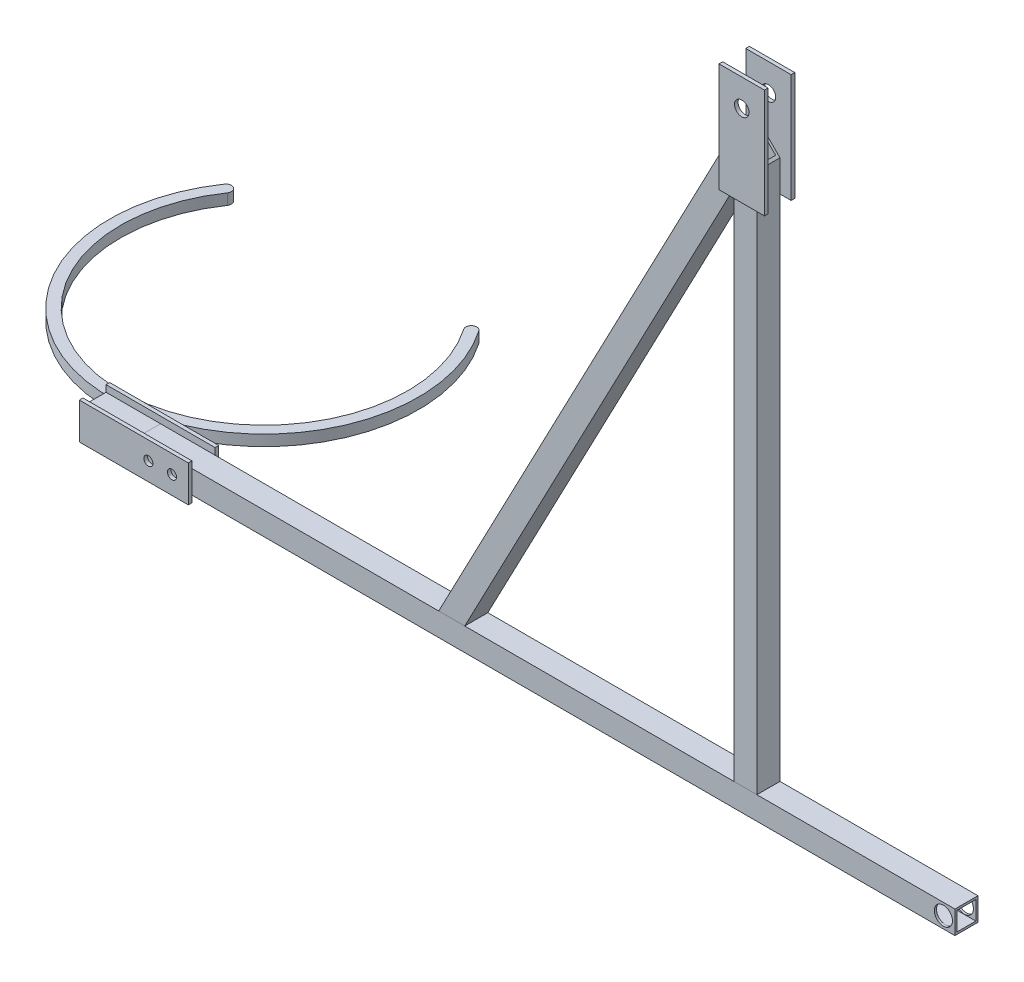
from build123d import *

# Parameters (mm, degrees)
SKETCH1_W               = 450
SKETCH1_H               = 12.7
SKETCH1_R               = 5
BOSS_EXTRUDE1_DEPTH     = 6.35
SHELL1_T                = -1.2
BOSS_EXTRUDE2_DEPTH     = 6.35
SHELL2_T                = -1.2
BOSS_EXTRUDE3_DEPTH     = 6.35
SHELL3_T                = -1.2
BOSS_EXTRUDE4_START     = 6.35
SKETCH1_5_W             = 25
SKETCH1_5_H             = 60
SKETCH1_5_R             = 4
BOSS_EXTRUDE4_DEPTH     = 2
CUT_EXTRUDE1_DEPTH      = 563.897297471
CUT_EXTRUDE1_DEPTH_BACK = 563.897297471
SKETCH1_6_R             = 5
SKETCH2_W               = 30
SKETCH2_H               = 12.7
SKETCH2_R               = 2.5
BOSS_EXTRUDE5_DEPTH     = 2
SKETCH4_W               = 12.7
SKETCH4_H               = 12.7
SKETCH4_W_2             = 10.3
SKETCH4_H_2             = 10.3
BOSS_EXTRUDE7_DEPTH     = 30
BOSS_EXTRUDE8_START     = -12.7
SKETCH2_6_W             = 30
SKETCH2_6_H             = 12.7
SKETCH2_6_R             = 2.5
BOSS_EXTRUDE8_DEPTH     = 2
BOSS_EXTRUDE9_DEPTH     = 3


with BuildPart() as part:
    # Sketch1 → Boss-Extrude1 (new, symmetric)
    # profile 1 of 2: a face of its own
    with BuildSketch(Plane.XY):
        with Locations((-218.65, 0)):
            Rectangle(SKETCH1_W, SKETCH1_H)
        Circle(SKETCH1_R, mode=Mode.SUBTRACT)
    # profile 2 of 2: a face of its own
    with BuildSketch(Plane.XY):
        Circle(SKETCH1_R)
    extrude(amount=BOSS_EXTRUDE1_DEPTH, both=True)

    # Shell1
    shell1_openings = [part.faces().sort_by_distance(p)[0] for p in [
        (-443.65, 0, 0),
        (6.35, 0, 0),
    ]]
    offset(amount=SHELL1_T, openings=shell1_openings, kind=Kind.INTERSECTION)

    # Sketch1<6> → Cut-Extrude1 (cut, two sides: drawn at the far end of the back side and taken through both)
    with BuildSketch(Plane.XY.offset(-CUT_EXTRUDE1_DEPTH_BACK)):
        Circle(SKETCH1_6_R)
    extrude(amount=CUT_EXTRUDE1_DEPTH + CUT_EXTRUDE1_DEPTH_BACK, mode=Mode.SUBTRACT)


with BuildPart() as body_2:
    # Sketch1<3> → Boss-Extrude2 (new, symmetric)
    with BuildSketch(Plane.XY):
        Polygon((-115.35, 288.99291613), (-115.35, 316.35), (-277.830768093, 6.35), (-263.492058415, 6.35), align=None)
    extrude(amount=BOSS_EXTRUDE2_DEPTH, both=True)

    # Shell2
    shell2_openings = [body_2.faces().sort_by_distance(p)[0] for p in [
        (-270.661413254, 6.35, 0),
        (-115.35, 302.671458065, 0),
    ]]
    offset(amount=SHELL2_T, openings=shell2_openings, kind=Kind.INTERSECTION)


with BuildPart() as body_3:
    # Sketch1<4> → Boss-Extrude3 (new, symmetric)
    with BuildSketch(Plane.XY):
        Polygon((-102.65, 303.65), (-115.35, 316.35), (-115.35, 6.35), (-102.65, 6.35), align=None)
    extrude(amount=BOSS_EXTRUDE3_DEPTH, both=True)

    # Shell3
    shell3_openings = [body_3.faces().sort_by_distance(p)[0] for p in [
        (-109, 6.35, 0),
        (-109, 310, 0),
    ]]
    offset(amount=SHELL3_T, openings=shell3_openings, kind=Kind.INTERSECTION)


with BuildPart() as body_4:
    # Sketch1<5> → Boss-Extrude4 (new body)
    with BuildSketch(Plane.XY.offset(BOSS_EXTRUDE4_START)):
        with Locations((-109, 316.35)):
            Rectangle(SKETCH1_5_W, SKETCH1_5_H)
        with Locations((-109, 331.35)):
            Circle(SKETCH1_5_R, mode=Mode.SUBTRACT)
    extrude(amount=BOSS_EXTRUDE4_DEPTH)


with BuildPart() as body_5:
    # Mirror1: mirrored copy
    add(body_4.part.mirror(Plane.XY))


with BuildPart() as body_6:
    # Sketch2 → Boss-Extrude5 (new body)
    # profile 1 of 4: a face of its own
    with BuildSketch(Plane.XY.offset(6.35)):
        Polygon((-443.65, -6.35), (-473.65, -6.35), (-473.65, -10), (-413.65, -10), (-413.65, -6.35), align=None)
    # profile 2 of 4: a face of its own
    with BuildSketch(Plane.XY.offset(6.35)):
        with Locations((-428.65, 0)):
            Rectangle(SKETCH2_W, SKETCH2_H)
        with Locations((-435.65, 0)):
            Circle(SKETCH2_R, mode=Mode.SUBTRACT)
        with Locations((-422.65, 0)):
            Circle(SKETCH2_R, mode=Mode.SUBTRACT)
    # profile 3 of 4: a face of its own
    with BuildSketch(Plane.XY.offset(6.35)):
        with Locations((-458.65, 0)):
            Rectangle(SKETCH2_W, SKETCH2_H)
    # profile 4 of 4: a face of its own
    with BuildSketch(Plane.XY.offset(6.35)):
        Polygon((-413.65, 10), (-473.65, 10), (-473.65, 6.35), (-443.65, 6.35), (-413.65, 6.35), align=None)
    extrude(amount=BOSS_EXTRUDE5_DEPTH)


with BuildPart() as body_7:
    # Sketch4 → Boss-Extrude7 (new body)
    with BuildSketch(Plane.ZY.offset(443.65)):
        Rectangle(SKETCH4_W, SKETCH4_H)
        Rectangle(SKETCH4_W_2, SKETCH4_H_2, mode=Mode.SUBTRACT)
    extrude(amount=BOSS_EXTRUDE7_DEPTH)


with BuildPart() as body_8:
    # Sketch2<6> → Boss-Extrude8 (new body)
    # profile 1 of 4: a face of its own
    with BuildSketch(Plane.XY.offset(6.35).offset(BOSS_EXTRUDE8_START)):
        Polygon((-443.65, -6.35), (-473.65, -6.35), (-473.65, -10), (-413.65, -10), (-413.65, -6.35), align=None)
    # profile 2 of 4: a face of its own
    with BuildSketch(Plane.XY.offset(6.35).offset(BOSS_EXTRUDE8_START)):
        with Locations((-458.65, 0)):
            Rectangle(SKETCH2_6_W, SKETCH2_6_H)
    # profile 3 of 4: a face of its own
    with BuildSketch(Plane.XY.offset(6.35).offset(BOSS_EXTRUDE8_START)):
        with Locations((-428.65, 0)):
            Rectangle(SKETCH2_6_W, SKETCH2_6_H)
        with Locations((-435.65, 0)):
            Circle(SKETCH2_6_R, mode=Mode.SUBTRACT)
        with Locations((-422.65, 0)):
            Circle(SKETCH2_6_R, mode=Mode.SUBTRACT)
    # profile 4 of 4: a face of its own
    with BuildSketch(Plane.XY.offset(6.35).offset(BOSS_EXTRUDE8_START)):
        Polygon((-413.65, 10), (-473.65, 10), (-473.65, 6.35), (-443.65, 6.35), (-413.65, 6.35), align=None)
    extrude(amount=-BOSS_EXTRUDE8_DEPTH)


with BuildPart() as body_9:
    # Sketch5 → Boss-Extrude9 (new, symmetric)
    with BuildSketch(Plane(origin=(0, 0, 0), x_dir=(1, 0, 0), z_dir=(0, 1, 0))):
        with BuildLine():
            ThreePointArc((-543.65, 141.568253805), (-473.65, 8.35), (-403.65, 141.568253805))
            ThreePointArc((-403.65, 141.568253805), (-407.822408958, 142.337021318), (-408.591176471, 138.16461236))
            ThreePointArc((-408.591176471, 138.16461236), (-473.65, 14.35), (-538.708823529, 138.16461236))
            ThreePointArc((-538.708823529, 138.16461236), (-539.477591042, 142.337021318), (-543.65, 141.568253805))
        make_face()
    extrude(amount=BOSS_EXTRUDE9_DEPTH, both=True)


solid = Compound([part.part, body_2.part, body_3.part, body_4.part, body_5.part, body_6.part, body_7.part, body_8.part, body_9.part])
